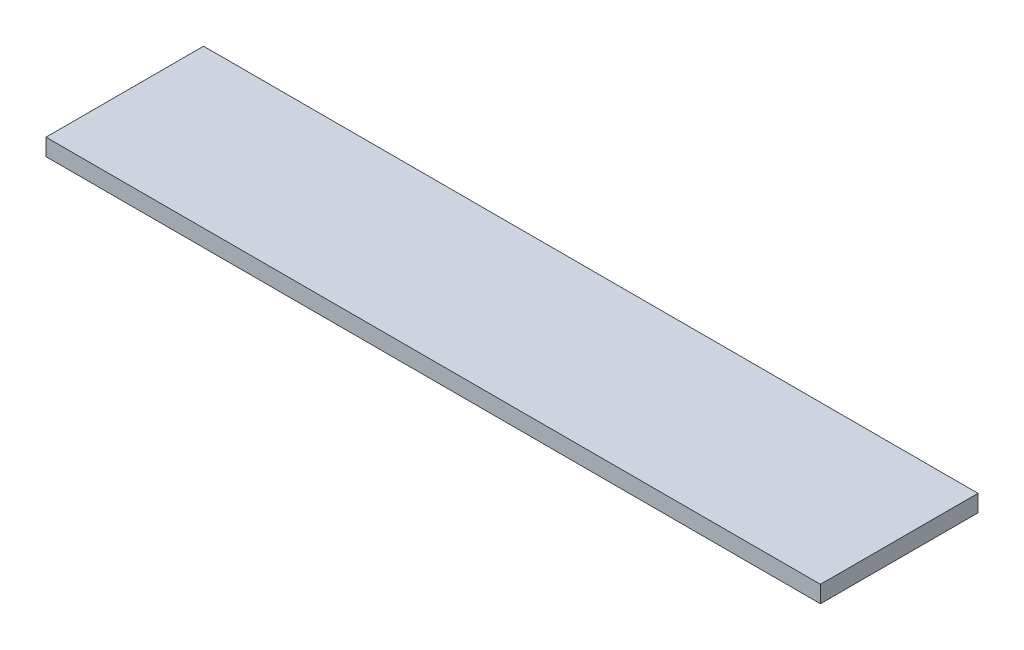
from build123d import *

# Parameters (mm, degrees)
SKETCH1_W           = 274.867917194
SKETCH1_H           = 55.918160176
BOSS_EXTRUDE1_DEPTH = 6


with BuildPart() as part:
    # Sketch1 → Boss-Extrude1 (new body)
    with BuildSketch(Plane(origin=(0, 0, 0), x_dir=(1, 0, 0), z_dir=(0, 1, 0))):
        with Locations((55.724412616, -1.03062149)):
            Rectangle(SKETCH1_W, SKETCH1_H)
    extrude(amount=BOSS_EXTRUDE1_DEPTH)


solid = part.part
